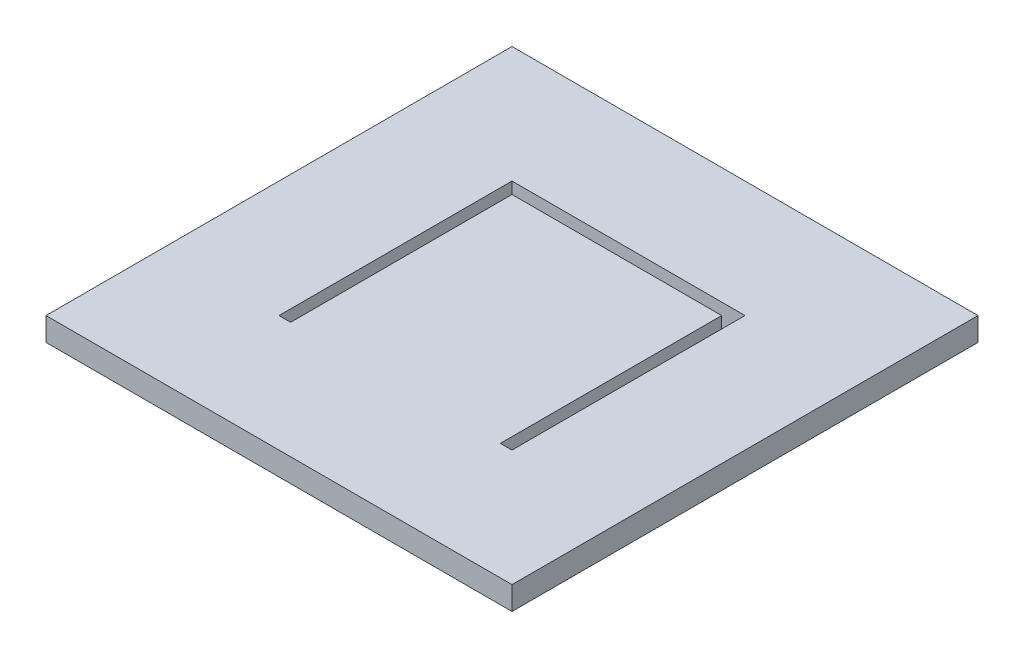
from build123d import *

# Parameters (mm, degrees)
SKETCH_1_W          = 200
SKETCH_1_H          = 200
EXTRUDE_1_DEPTH     = 10
CUT_EXTRUDE_1_DEPTH = 10


with BuildPart() as part:
    # 草圖1 → 填料-伸長1 (new body)
    with BuildSketch(Plane(origin=(0, 0, 0), x_dir=(1, 0, 0), z_dir=(0, 1, 0))):
        Rectangle(SKETCH_1_W, SKETCH_1_H)
    extrude(amount=-EXTRUDE_1_DEPTH)

    # 草圖1<3> → 除料-伸長-薄件1 (cut)
    with BuildSketch(Plane(origin=(0, 0, 0), x_dir=(1, 0, 0), z_dir=(0, 1, 0))):
        Polygon((-50, -50), (-50, 50), (50, 50), (50, -50), (45, -50), (45, 45), (-45, 45), (-45, -50), align=None)
    extrude(amount=-CUT_EXTRUDE_1_DEPTH, mode=Mode.SUBTRACT)


solid = part.part
